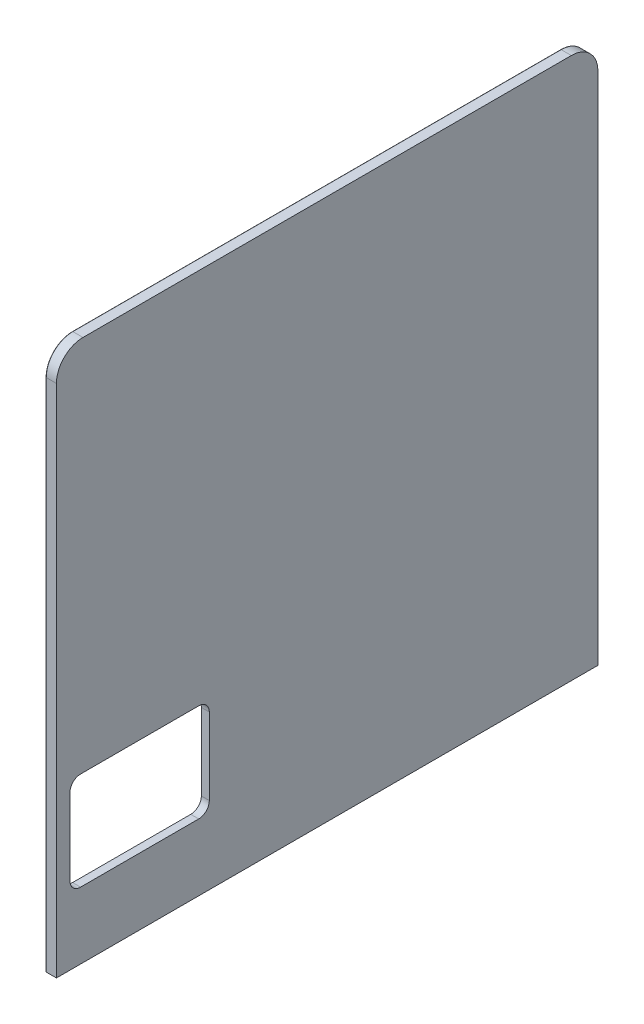
from build123d import *

# Parameters (mm, degrees)
BOSS_EXTRUDE1_DEPTH = 4
CUT_EXTRUDE3_START  = -4
CUT_EXTRUDE3_DEPTH  = 1
FILLET1_R           = 0.2
CUT_EXTRUDE4_REACH  = 146.305


with BuildPart() as part:
    # Sketch1 → Boss-Extrude1 (new body)
    with BuildSketch(Plane(origin=(0, 0, 0), x_dir=(0, 0, -1), z_dir=(1, 0, 0))):
        with BuildLine():
            Line((-102, -102), (102, -102))
            Line((102, -102), (102, 92))
            ThreePointArc((102, 92), (99.071067812, 99.071067812), (92, 102))
            Line((92, 102), (-92, 102))
            ThreePointArc((-92, 102), (-99.071067812, 99.071067812), (-102, 92))
            Line((-102, 92), (-102, -102))
        make_face()
    extrude(amount=BOSS_EXTRUDE1_DEPTH)

    # Sketch2 → Cut-Extrude3 (cut)
    with BuildSketch(Plane(origin=(4, 0, 0), x_dir=(0, 0, -1), z_dir=(1, 0, 0)).offset(CUT_EXTRUDE3_START)):
        with BuildLine():
            Line((-100.1, 90.3), (-100.1, -70.3))
            ThreePointArc((-100.1, -70.3), (-97.229646456, -77.229646456), (-90.3, -80.1))
            Line((-90.3, -80.1), (70.3, -80.1))
            ThreePointArc((70.3, -80.1), (77.229646456, -77.229646456), (80.1, -70.3))
            Line((80.1, -70.3), (80.1, 78))
            ThreePointArc((80.1, 78), (78, 80.1), (75.9, 78))
            Line((75.9, 78), (75.9, -65.7))
            ThreePointArc((75.9, -65.7), (72.912489168, -72.912489168), (65.7, -75.9))
            Line((65.7, -75.9), (-40.2, -75.9))
            ThreePointArc((-40.2, -75.9), (-42.321320344, -75.021320344), (-43.2, -72.9))
            Line((-43.2, -72.9), (-43.2, -42.8))
            ThreePointArc((-43.2, -42.8), (-44.371572875, -39.971572875), (-47.2, -38.8))
            Line((-47.2, -38.8), (-92.9, -38.8))
            ThreePointArc((-92.9, -38.8), (-95.021320344, -37.921320344), (-95.9, -35.8))
            Line((-95.9, -35.8), (-95.9, 85.7))
            ThreePointArc((-95.9, 85.7), (-92.912489168, 92.912489168), (-85.7, 95.9))
            Line((-85.7, 95.9), (85.7, 95.9))
            ThreePointArc((85.7, 95.9), (92.912489168, 92.912489168), (95.9, 85.7))
            Line((95.9, 85.7), (95.9, -85.7))
            ThreePointArc((95.9, -85.7), (92.912489168, -92.912489168), (85.7, -95.9))
            Line((85.7, -95.9), (-97.3, -95.9))
            ThreePointArc((-97.3, -95.9), (-99.279898987, -96.720101013), (-100.1, -98.7))
            Line((-100.1, -98.7), (-100.1, -100.1))
            Line((-100.1, -100.1), (90.3, -100.1))
            ThreePointArc((90.3, -100.1), (97.229646456, -97.229646456), (100.1, -90.3))
            Line((100.1, -90.3), (100.1, 90.3))
            ThreePointArc((100.1, 90.3), (97.229646456, 97.229646456), (90.3, 100.1))
            Line((90.3, 100.1), (-90.3, 100.1))
            ThreePointArc((-90.3, 100.1), (-97.229646456, 97.229646456), (-100.1, 90.3))
        make_face()
        with BuildLine():
            Line((-90.9, -75.9), (-48.4, -75.9))
            ThreePointArc((-48.4, -75.9), (-46.278679656, -75.021320344), (-45.4, -72.9))
            Line((-45.4, -72.9), (-45.4, -65.9))
            Line((-45.4, -65.9), (-46.4, -65.9))
            Line((-46.4, -65.9), (-46.4, -64.4))
            Line((-46.4, -64.4), (-45.4, -64.4))
            Line((-45.4, -64.4), (-45.4, -62.5))
            Line((-45.4, -62.5), (-46.4, -62.5))
            Line((-46.4, -62.5), (-46.4, -61))
            Line((-46.4, -61), (-45.4, -61))
            Line((-45.4, -61), (-45.4, -45))
            ThreePointArc((-45.4, -45), (-46.571572875, -42.171572875), (-49.4, -41))
            Line((-49.4, -41), (-92.9, -41))
            ThreePointArc((-92.9, -41), (-95.021320344, -41.878679656), (-95.9, -44))
            Line((-95.9, -44), (-95.9, -61))
            Line((-95.9, -61), (-94.9, -61))
            Line((-94.9, -61), (-94.9, -62.5))
            Line((-94.9, -62.5), (-95.9, -62.5))
            Line((-95.9, -62.5), (-95.9, -64.4))
            Line((-95.9, -64.4), (-94.9, -64.4))
            Line((-94.9, -64.4), (-94.9, -65.9))
            Line((-94.9, -65.9), (-95.9, -65.9))
            Line((-95.9, -65.9), (-95.9, -70.9))
            ThreePointArc((-95.9, -70.9), (-94.435533906, -74.435533906), (-90.9, -75.9))
        make_face(mode=Mode.SUBTRACT)
    extrude(amount=CUT_EXTRUDE3_DEPTH, mode=Mode.SUBTRACT)

    # Fillet1
    fillet1_edges = [part.edges().sort_by_distance(p)[0] for p in [
        (0, -72.912489168, -72.912489168),
        (0, -75.021320344, 42.321320344),
        (0, -37.921320344, 95.021320344),
        (0, 92.912489168, 92.912489168),
        (0, 92.912489168, -92.912489168),
        (0, -92.912489168, -92.912489168),
        (0, -96.720101013, 99.279898987),
        (0, -95.9, 5.8),
        (0, 0, -95.9),
        (0, 95.9, 0),
        (0, 24.95, 95.9),
        (0, -38.8, 70.05),
        (0, -39.971572875, 44.371572875),
        (0, -57.85, 43.2),
        (0, -75.9, -12.75),
        (0, 6.15, -75.9),
        (0, 80.1, -78),
        (0, 3.85, -80.1),
        (0, -77.229646456, -77.229646456),
        (0, -80.1, 10),
        (0, -77.229646456, 97.229646456),
        (0, 10, 100.1),
        (0, 97.229646456, 97.229646456),
        (0, 100.1, 0),
        (0, 97.229646456, -97.229646456),
        (0, -102, 0),
        (0, 0, -100.1),
        (0, -97.229646456, -97.229646456),
        (0, -100.1, 4.9),
        (0, -99.4, 100.1),
        (0, -65.15, 94.9),
        (0, -65.9, 95.4),
        (0, -68.4, 95.9),
        (0, -74.435533906, 94.435533906),
        (0, -75.9, 69.65),
        (0, -75.021320344, 46.278679656),
        (0, -69.4, 45.4),
        (0, -5, 102),
        (0, -65.9, 45.9),
        (0, -65.15, 46.4),
        (0, -64.4, 45.9),
        (0, -63.45, 45.4),
        (0, -62.5, 45.9),
        (0, -61.75, 46.4),
        (0, -61, 45.9),
        (0, -53, 45.4),
        (0, -42.171572875, 46.571572875),
        (0, -41, 71.15),
        (0, 99.071067812, 99.071067812),
        (0, -41.878679656, 95.021320344),
        (0, -52.5, 95.9),
        (0, -61, 95.4),
        (0, -61.75, 94.9),
        (0, -62.5, 95.4),
        (0, -63.45, 95.9),
        (0, -64.4, 95.4),
        (0, 102, 0),
        (0, 99.071067812, -99.071067812),
        (0, -5, -102),
    ]]
    fillet(fillet1_edges, radius=FILLET1_R)

    # Sketch4 → Cut-Extrude4 (cut, up to next)
    with BuildSketch(Plane(origin=(4, 0, 0), x_dir=(0, 0, -1), z_dir=(1, 0, 0)), mode=Mode.PRIVATE) as cut_extrude4_sk1:
        with BuildLine():
            Line((-92.9, -40), (-48.4, -40))
            ThreePointArc((-48.4, -40), (-45.571572875, -41.171572875), (-44.4, -44))
            Line((-44.4, -44), (-44.4, -72.9))
            ThreePointArc((-44.4, -72.9), (-45.571572875, -75.728427125), (-48.4, -76.9))
            Line((-48.4, -76.9), (-92.9, -76.9))
            ThreePointArc((-92.9, -76.9), (-95.728427125, -75.728427125), (-96.9, -72.9))
            Line((-96.9, -72.9), (-96.9, -44))
            ThreePointArc((-96.9, -44), (-95.728427125, -41.171572875), (-92.9, -40))
        make_face()
    cut_extrude4_tool1 = extrude(cut_extrude4_sk1.sketch, amount=-CUT_EXTRUDE4_REACH, mode=Mode.PRIVATE) & part.part
    add(cut_extrude4_tool1.solids().sort_by_distance((4, -58.45, 70.65))[0], mode=Mode.SUBTRACT)


solid = part.part
